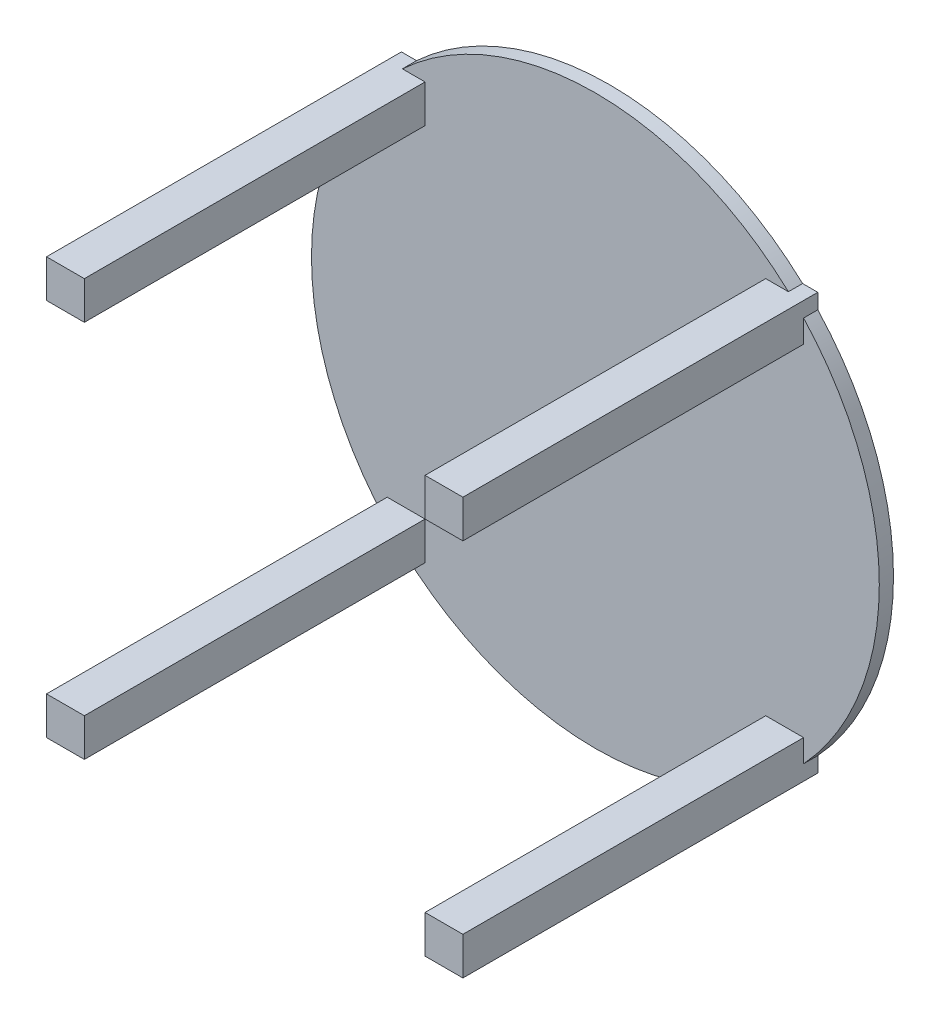
from build123d import *

# Parameters (mm, degrees)
SKETCH_1_R      = 600
EXTRUDE_1_DEPTH = 30
SKETCH_2_W      = 80
SKETCH_2_H      = 80
EXTRUDE_2_DEPTH = 750
SKETCH_3_W      = 80
SKETCH_3_H      = 80
EXTRUDE_3_DEPTH = 750
SKETCH_4_W      = 80
SKETCH_4_H      = 80
EXTRUDE_4_DEPTH = 750
SKETCH_5_W      = 80
SKETCH_5_H      = 80
EXTRUDE_5_DEPTH = 750


with BuildPart() as part:
    # 草图1 → 凸台-拉伸1 (new body)
    with BuildSketch(Plane.XY):
        Circle(SKETCH_1_R)
    extrude(amount=EXTRUDE_1_DEPTH)

    # 草图2 → 凸台-拉伸2 (add)
    with BuildSketch(Plane.XY):
        with Locations((-400, -400)):
            Rectangle(SKETCH_2_W, SKETCH_2_H)
    extrude(amount=EXTRUDE_2_DEPTH)

    # 草图3 → 凸台-拉伸3 (add)
    with BuildSketch(Plane.XY):
        with Locations((400, -400)):
            Rectangle(SKETCH_3_W, SKETCH_3_H)
    extrude(amount=EXTRUDE_3_DEPTH)

    # 草图4 → 凸台-拉伸4 (add)
    with BuildSketch(Plane.XY):
        with Locations((-400, 400)):
            Rectangle(SKETCH_4_W, SKETCH_4_H)
    extrude(amount=EXTRUDE_4_DEPTH)

    # 草图5 → 凸台-拉伸5 (add)
    with BuildSketch(Plane.XY):
        with Locations((400, 400)):
            Rectangle(SKETCH_5_W, SKETCH_5_H)
    extrude(amount=EXTRUDE_5_DEPTH)


solid = part.part
